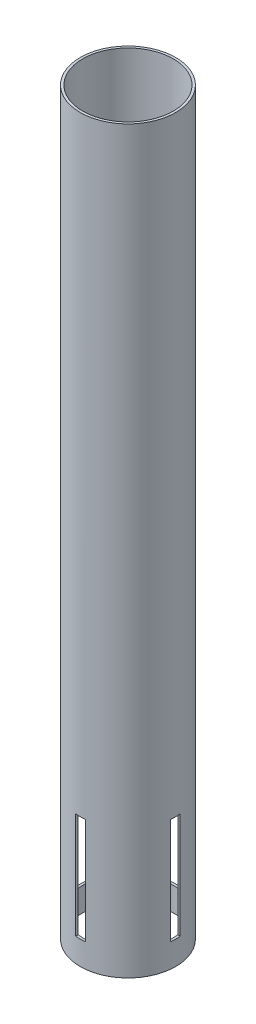
from build123d import *

# Parameters (mm, degrees)
SKETCH1_R               = 50.8
SKETCH1_R_2             = 48.26
BOSS_EXTRUDE1_DEPTH     = 787.4
CUT_EXTRUDE1_DEPTH      = 791.670626747
CUT_EXTRUDE1_DEPTH_BACK = 791.670626747
SKETCH2_W               = 10.16
SKETCH2_H               = 112.776
CUT_EXTRUDE2_DEPTH      = 791.670626747
CUT_EXTRUDE2_DEPTH_BACK = 791.670626747
SKETCH3_W               = 10.16
SKETCH3_H               = 112.776


with BuildPart() as part:
    # Sketch1 → Boss-Extrude1 (new body)
    with BuildSketch(Plane(origin=(0, 0, 0), x_dir=(1, 0, 0), z_dir=(0, 1, 0))):
        with Locations(Location((0, 0, 0), (0, 0, 270))):
            Circle(SKETCH1_R)
        with Locations(Location((0, 0, 0), (0, 0, 270))):
            Circle(SKETCH1_R_2, mode=Mode.SUBTRACT)
    extrude(amount=BOSS_EXTRUDE1_DEPTH)

    # Sketch2 → Cut-Extrude1 (cut, two sides: drawn at the far end of the back side and taken through both)
    with BuildSketch(Plane.XY.offset(-CUT_EXTRUDE1_DEPTH_BACK)):
        with Locations((0, 81.788)):
            Rectangle(SKETCH2_W, SKETCH2_H)
    extrude(amount=CUT_EXTRUDE1_DEPTH + CUT_EXTRUDE1_DEPTH_BACK, mode=Mode.SUBTRACT)

    # Sketch3 → Cut-Extrude2 (cut, two sides: drawn at the far end of the back side and taken through both)
    with BuildSketch(Plane(origin=(0, 0, 0), x_dir=(0, 0, -1), z_dir=(1, 0, 0)).offset(-CUT_EXTRUDE2_DEPTH_BACK)):
        with Locations((0, 81.788)):
            Rectangle(SKETCH3_W, SKETCH3_H)
    extrude(amount=CUT_EXTRUDE2_DEPTH + CUT_EXTRUDE2_DEPTH_BACK, mode=Mode.SUBTRACT)


solid = part.part
